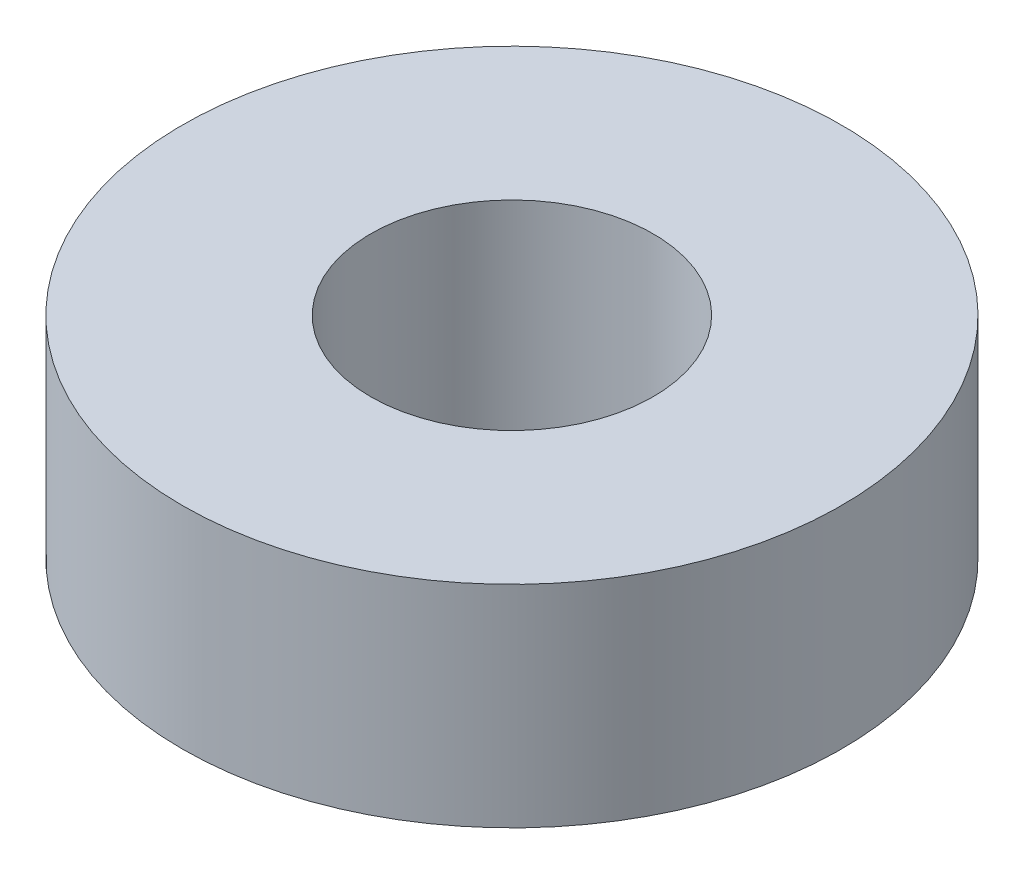
from build123d import *

# Parameters (mm, degrees)
SKETCH1_R           = 11.1125
SKETCH1_R_2         = 4.7625
BOSS_EXTRUDE1_DEPTH = 7.112


with BuildPart() as part:
    # Sketch1 → Boss-Extrude1 (new body)
    with BuildSketch(Plane(origin=(0, 0, 0), x_dir=(1, 0, 0), z_dir=(0, 1, 0))):
        with Locations(Location((0, 0, 0), (0, 0, 270))):
            Circle(SKETCH1_R)
        with Locations(Location((0, 0, 0), (0, 0, 270))):
            Circle(SKETCH1_R_2, mode=Mode.SUBTRACT)
    extrude(amount=BOSS_EXTRUDE1_DEPTH)


solid = part.part
